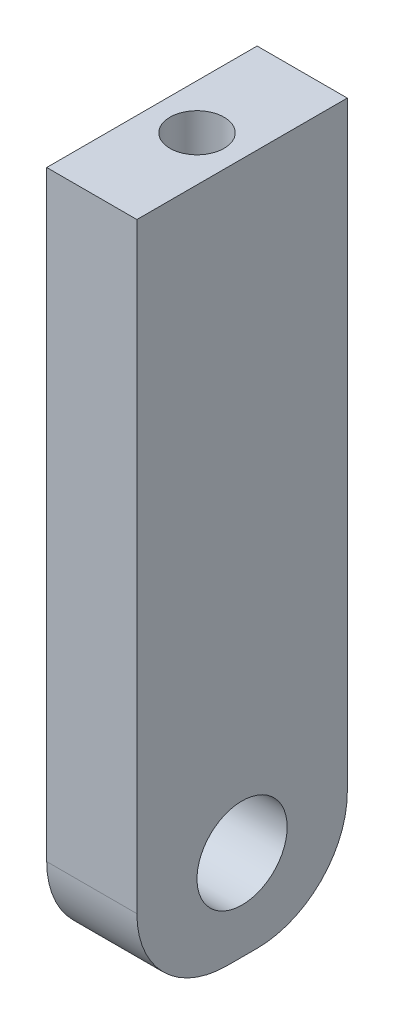
from build123d import *

# Parameters (mm, degrees)
SKETCH_1_W          = 3
SKETCH_1_H          = 23
EXTRUDE_1_DEPTH     = 7
SKETCH_4_R          = 1.5
CUT_EXTRUDE_2_DEPTH = 24.71013886
FILLET_1_R          = 3
SKETCH_3_R          = 0.9
CUT_EXTRUDE_4_DEPTH = 7


with BuildPart() as part:
    # 草图1 → 凸台-拉伸1 (new body)
    with BuildSketch(Plane.XY):
        with Locations((1.5, -10.953745451)):
            Rectangle(SKETCH_1_W, SKETCH_1_H)
    extrude(amount=EXTRUDE_1_DEPTH)

    # 草图4 → 切除-拉伸2 (cut, through all)
    with BuildSketch(Plane(origin=(3, 0, 0), x_dir=(0, 0, -1), z_dir=(1, 0, 0))):
        with Locations((-3.5, -19.453745451)):
            Circle(SKETCH_4_R)
    extrude(amount=-CUT_EXTRUDE_2_DEPTH, mode=Mode.SUBTRACT)

    # 圆角1
    fillet_1_edges = [part.edges().sort_by_distance(p)[0] for p in [
        (1.5, -22.453745451, 7),
        (1.5, -22.453745451, 0),
    ]]
    fillet(fillet_1_edges, radius=FILLET_1_R)

    # 草图3 → 切除-拉伸4 (cut)
    with BuildSketch(Plane(origin=(0, 0.546254549, 0), x_dir=(1, 0, 0), z_dir=(0, 1, 0))):
        with Locations(Location((1.5, -3.5, 0), (0, 0, 180))):
            Circle(SKETCH_3_R)
    extrude(amount=-CUT_EXTRUDE_4_DEPTH, mode=Mode.SUBTRACT)


solid = part.part
